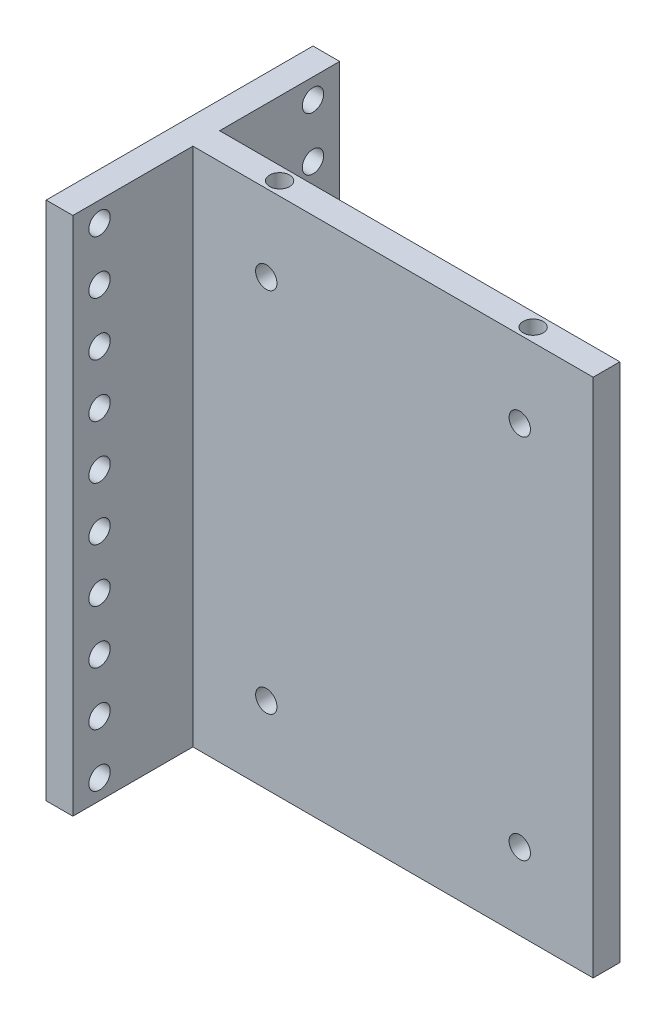
from build123d import *

# Parameters (mm, degrees)
SKETCH_1_W          = 60
SKETCH_1_H          = 78
SKETCH_1_R          = 1.6
EXTRUDE_1_DEPTH     = 4
SKETCH_2_W          = 40
SKETCH_2_H          = 78
SKETCH_2_R          = 1.6
EXTRUDE_2_DEPTH     = 4
SKETCH_3_R          = 1.5
CUT_EXTRUDE_1_DEPTH = 5
CUT_EXTRUDE_START   = -5
SKETCH_4_R          = 1.5
CUT_EXTRUDE_2_DEPTH = 5


with BuildPart() as part:
    # Эскиз1 → Бобышка-Вытянуть1 (new body)
    with BuildSketch(Plane.XY):
        Rectangle(SKETCH_1_W, SKETCH_1_H)
        with Locations((-19, 27.5)):
            Circle(SKETCH_1_R, mode=Mode.SUBTRACT)
        with Locations((19, 27.5)):
            Circle(SKETCH_1_R, mode=Mode.SUBTRACT)
        with Locations((19, -27.5)):
            Circle(SKETCH_1_R, mode=Mode.SUBTRACT)
        with Locations((-19, -27.5)):
            Circle(SKETCH_1_R, mode=Mode.SUBTRACT)
    extrude(amount=EXTRUDE_1_DEPTH)

    # Эскиз2 → Бобышка-Вытянуть2 (add)
    with BuildSketch(Plane.ZY.offset(30)):
        with Locations((2, 0)):
            Rectangle(SKETCH_2_W, SKETCH_2_H)
        with Locations((-14, 36)):
            Circle(SKETCH_2_R, mode=Mode.SUBTRACT)
        with Locations((18, 36)):
            Circle(SKETCH_2_R, mode=Mode.SUBTRACT)
        with Locations((18, 28)):
            Circle(SKETCH_2_R, mode=Mode.SUBTRACT)
        with Locations((18, 20)):
            Circle(SKETCH_2_R, mode=Mode.SUBTRACT)
        with Locations((18, 12)):
            Circle(SKETCH_2_R, mode=Mode.SUBTRACT)
        with Locations((18, 4)):
            Circle(SKETCH_2_R, mode=Mode.SUBTRACT)
        with Locations((18, -4)):
            Circle(SKETCH_2_R, mode=Mode.SUBTRACT)
        with Locations((18, -12)):
            Circle(SKETCH_2_R, mode=Mode.SUBTRACT)
        with Locations((18, -20)):
            Circle(SKETCH_2_R, mode=Mode.SUBTRACT)
        with Locations((18, -28)):
            Circle(SKETCH_2_R, mode=Mode.SUBTRACT)
        with Locations((18, -36)):
            Circle(SKETCH_2_R, mode=Mode.SUBTRACT)
        with Locations((-14, 28)):
            Circle(SKETCH_2_R, mode=Mode.SUBTRACT)
        with Locations((-14, 20)):
            Circle(SKETCH_2_R, mode=Mode.SUBTRACT)
        with Locations((-14, 12)):
            Circle(SKETCH_2_R, mode=Mode.SUBTRACT)
        with Locations((-14, 4)):
            Circle(SKETCH_2_R, mode=Mode.SUBTRACT)
        with Locations((-14, -4)):
            Circle(SKETCH_2_R, mode=Mode.SUBTRACT)
        with Locations((-14, -12)):
            Circle(SKETCH_2_R, mode=Mode.SUBTRACT)
        with Locations((-14, -20)):
            Circle(SKETCH_2_R, mode=Mode.SUBTRACT)
        with Locations((-14, -28)):
            Circle(SKETCH_2_R, mode=Mode.SUBTRACT)
        with Locations((-14, -36)):
            Circle(SKETCH_2_R, mode=Mode.SUBTRACT)
    extrude(amount=EXTRUDE_2_DEPTH)

    # Эскиз3 → Вырез-Вытянуть1 (cut)
    with BuildSketch(Plane.XZ.offset(39)):
        with Locations((-19, 2)):
            Circle(SKETCH_3_R)
        with Locations((19, 2)):
            Circle(SKETCH_3_R)
    extrude(amount=-CUT_EXTRUDE_1_DEPTH, mode=Mode.SUBTRACT)

    # Эскиз4 → Вырез-Вытянуть2 (cut)
    with BuildSketch(Plane(origin=(0, 39, 0), x_dir=(1, 0, 0), z_dir=(0, 1, 0)).offset(CUT_EXTRUDE_START)):
        with Locations((-19, -2)):
            Circle(SKETCH_4_R)
        with Locations((19, -2)):
            Circle(SKETCH_4_R)
    extrude(amount=CUT_EXTRUDE_2_DEPTH, mode=Mode.SUBTRACT)


solid = part.part
